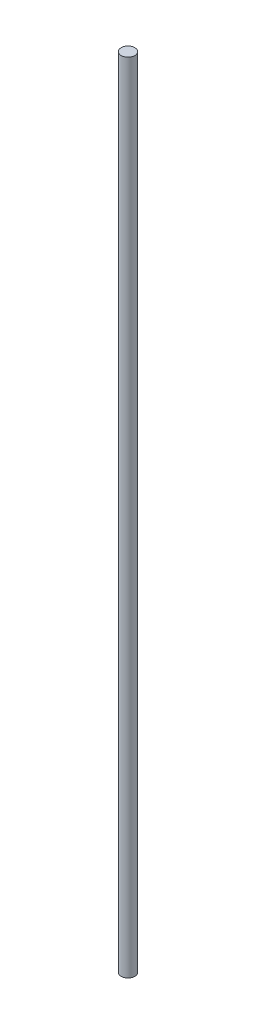
from build123d import *

# Parameters (mm, degrees)
SKETCH1_R           = 1.5
BOSS_EXTRUDE1_DEPTH = 87.5


with BuildPart() as part:
    # Sketch1 → Boss-Extrude1 (new, symmetric)
    with BuildSketch(Plane(origin=(0, 0, 0), x_dir=(1, 0, 0), z_dir=(0, 1, 0))):
        Circle(SKETCH1_R)
    extrude(amount=BOSS_EXTRUDE1_DEPTH, both=True)


solid = part.part
